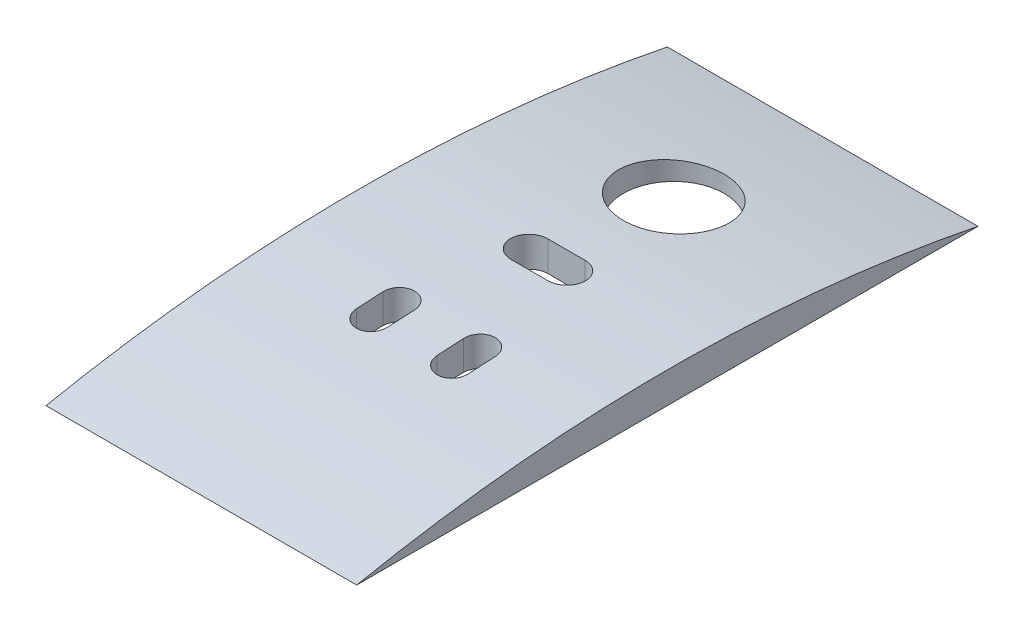
from build123d import *

# Parameters (mm, degrees)
SKETCH1_W           = 50.8
SKETCH1_H           = 101.6
BOSS_EXTRUDE1_DEPTH = 76.962
CUT_EXTRUDE1_DEPTH  = 138.209144899
SKETCH6_R           = 8.255
CUT_EXTRUDE2_DEPTH  = 114.705788771
CUT_EXTRUDE3_DEPTH  = 114.705788909


with BuildPart() as part:
    # Sketch1 → Boss-Extrude1 (new body)
    with BuildSketch(Plane(origin=(0, 0, 0), x_dir=(1, 0, 0), z_dir=(0, 1, 0))):
        with Locations((25.4, 50.8)):
            Rectangle(SKETCH1_W, SKETCH1_H)
    extrude(amount=BOSS_EXTRUDE1_DEPTH)

    # Sketch2 → Cut-Extrude1 (cut, through all)
    with BuildSketch(Plane(origin=(50.8, 0, 0), x_dir=(0, 0, -1), z_dir=(1, 0, 0))):
        with BuildLine():
            ThreePointArc((0, 0), (50.8, 5.08), (101.6, 0))
            Line((101.6, 0), (101.6, 76.962))
            Line((101.6, 76.962), (0, 76.962))
            Line((0, 76.962), (0, 0))
        make_face()
    extrude(amount=-CUT_EXTRUDE1_DEPTH, mode=Mode.SUBTRACT)

    # Sketch6 → Cut-Extrude2 (cut, through all)
    with BuildSketch(Plane.XZ):
        with Locations(Location((25.4, -77.250605012, 0), (0, 0, 270))):
            Circle(SKETCH6_R)
    extrude(amount=-CUT_EXTRUDE2_DEPTH, mode=Mode.SUBTRACT)

    # Sketch5 → Cut-Extrude3 (cut, through all)
    with BuildSketch(Plane.XZ):
        with BuildLine():
            Line((21.377665877, -34.538594366), (21.377665877, -38.875260441))
            ThreePointArc((21.377665877, -38.875260441), (18.798754023, -41.454172295), (16.219842169, -38.875260441))
            Line((16.219842169, -38.875260441), (16.219842169, -34.538594366))
            ThreePointArc((16.219842169, -34.538594366), (18.798754023, -31.959682512), (21.377665877, -34.538594366))
        make_face()
        with BuildLine():
            Line((34.582973156, -34.538594366), (34.582973156, -38.875260441))
            ThreePointArc((34.582973156, -38.875260441), (32.004061302, -41.454172295), (29.425149448, -38.875260441))
            Line((29.425149448, -38.875260441), (29.425149448, -34.538594366))
            ThreePointArc((29.425149448, -34.538594366), (32.004061302, -31.959682512), (34.582973156, -34.538594366))
        make_face()
        with BuildLine():
            Line((22.354769429, -53.669734582), (28.407840078, -53.669734582))
            ThreePointArc((28.407840078, -53.669734582), (31.442451437, -56.704345941), (28.407840078, -59.7389573))
            Line((28.407840078, -59.7389573), (22.354769429, -59.7389573))
            ThreePointArc((22.354769429, -59.7389573), (19.32015807, -56.704345941), (22.354769429, -53.669734582))
        make_face()
    extrude(amount=-CUT_EXTRUDE3_DEPTH, mode=Mode.SUBTRACT)


solid = part.part
